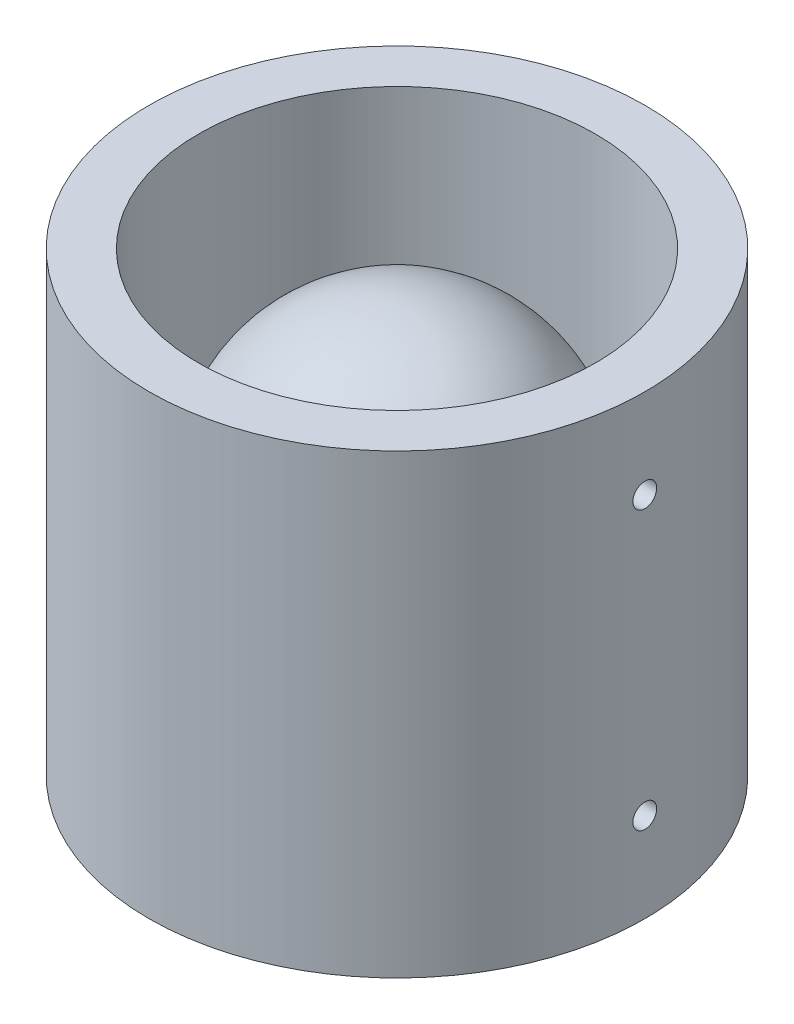
from build123d import *

# Parameters (mm, degrees)
SKETCH1_W               = 2
SKETCH1_H               = 1
SKETCH1_W_2             = 2.5
SKETCH1_H_2             = 23
CUT_EXTRUDE1_REACH      = 38.197
CUT_EXTRUDE1_END_RADIUS = 10


with BuildPart() as part:
    # Sketch1 → Revolve1 (revolve)
    with BuildSketch(Plane.XY, mode=Mode.PRIVATE) as revolve1_sk:
        with BuildLine():
            Line((0, 20.5), (0, 18.9))
            ThreePointArc((0, 18.9), (5.024937811, 16.693186096), (6.8, 11.5))
            Line((6.8, 11.5), (8, 11.5))
            Line((8, 11.5), (8, 12.5))
            ThreePointArc((8, 12.5), (5.656854249, 18.156854249), (0, 20.5))
        make_face()
        with Locations((9, 12)):
            Rectangle(SKETCH1_W, SKETCH1_H)
        with Locations((11.25, 11.5)):
            Rectangle(SKETCH1_W_2, SKETCH1_H_2)
    revolve(revolve1_sk.sketch.rotate(Axis((0, 0, 0), (0, 1, 0)), 90), axis=Axis((0, 0, 0), (0, 1, 0)))

    # Cut-Extrude1: up to this cylinder (the profile starts outside it)
    cut_extrude1_end = Plane(origin=(0, 11.5, 0), z_dir=(0, -1, 0)) * Cylinder(CUT_EXTRUDE1_END_RADIUS, 111.394, mode=Mode.PRIVATE)
    # Sketch2 → Cut-Extrude1 (cut, up to the surface)
    with BuildSketch(Plane(origin=(12.5, 0, 0), x_dir=(0, 0, -1), z_dir=(1, 0, 0)), mode=Mode.PRIVATE) as cut_extrude1_sk1:
        with BuildLine():
            ThreePointArc((0, 19.1), (-0.6, 18.5), (0, 17.9))
            Line((0, 17.9), (0, 19.1))
        make_face()
    cut_extrude1_tool1 = extrude(cut_extrude1_sk1.sketch, amount=-CUT_EXTRUDE1_REACH, mode=Mode.PRIVATE) - cut_extrude1_end
    add(cut_extrude1_tool1.solids().sort_by_distance((12.5, 18.5, 0.254648))[0], mode=Mode.SUBTRACT)
    # Sketch2 → Cut-Extrude1 (cut, up to the surface)
    with BuildSketch(Plane(origin=(12.5, 0, 0), x_dir=(0, 0, -1), z_dir=(1, 0, 0)), mode=Mode.PRIVATE) as cut_extrude1_sk2:
        with BuildLine():
            Line((0, 19.1), (0, 17.9))
            ThreePointArc((0, 17.9), (0.424264069, 18.075735931), (0.6, 18.5))
            ThreePointArc((0.6, 18.5), (0.424264069, 18.924264069), (0, 19.1))
        make_face()
    cut_extrude1_tool2 = extrude(cut_extrude1_sk2.sketch, amount=-CUT_EXTRUDE1_REACH, mode=Mode.PRIVATE) - cut_extrude1_end
    add(cut_extrude1_tool2.solids().sort_by_distance((12.5, 18.5, -0.254648))[0], mode=Mode.SUBTRACT)
    # Sketch2 → Cut-Extrude1 (cut, up to the surface)
    with BuildSketch(Plane(origin=(12.5, 0, 0), x_dir=(0, 0, -1), z_dir=(1, 0, 0)), mode=Mode.PRIVATE) as cut_extrude1_sk3:
        with BuildLine():
            ThreePointArc((0, 19.1), (-0.6, 18.5), (0, 17.9))
            Line((0, 17.9), (0, 19.1))
        make_face()
    cut_extrude1_tool3 = extrude(cut_extrude1_sk3.sketch, amount=-CUT_EXTRUDE1_REACH, mode=Mode.PRIVATE) - cut_extrude1_end
    add(cut_extrude1_tool3.solids().sort_by_distance((12.5, 18.5, 0.254648))[0], mode=Mode.SUBTRACT)
    # Sketch2 → Cut-Extrude1 (cut, up to the surface)
    with BuildSketch(Plane(origin=(12.5, 0, 0), x_dir=(0, 0, -1), z_dir=(1, 0, 0)), mode=Mode.PRIVATE) as cut_extrude1_sk4:
        with BuildLine():
            Line((0, 19.1), (0, 17.9))
            ThreePointArc((0, 17.9), (0.424264069, 18.075735931), (0.6, 18.5))
            ThreePointArc((0.6, 18.5), (0.424264069, 18.924264069), (0, 19.1))
        make_face()
    cut_extrude1_tool4 = extrude(cut_extrude1_sk4.sketch, amount=-CUT_EXTRUDE1_REACH, mode=Mode.PRIVATE) - cut_extrude1_end
    add(cut_extrude1_tool4.solids().sort_by_distance((12.5, 18.5, -0.254648))[0], mode=Mode.SUBTRACT)
    # Sketch2 → Cut-Extrude1 (cut, up to the surface)
    with BuildSketch(Plane(origin=(12.5, 0, 0), x_dir=(0, 0, -1), z_dir=(1, 0, 0)), mode=Mode.PRIVATE) as cut_extrude1_sk5:
        with BuildLine():
            ThreePointArc((0, 5.1), (-0.6, 4.5), (0, 3.9))
            Line((0, 3.9), (0, 5.1))
        make_face()
    cut_extrude1_tool5 = extrude(cut_extrude1_sk5.sketch, amount=-CUT_EXTRUDE1_REACH, mode=Mode.PRIVATE) - cut_extrude1_end
    add(cut_extrude1_tool5.solids().sort_by_distance((12.5, 4.5, 0.254648))[0], mode=Mode.SUBTRACT)
    # Sketch2 → Cut-Extrude1 (cut, up to the surface)
    with BuildSketch(Plane(origin=(12.5, 0, 0), x_dir=(0, 0, -1), z_dir=(1, 0, 0)), mode=Mode.PRIVATE) as cut_extrude1_sk6:
        with BuildLine():
            Line((0, 5.1), (0, 3.9))
            ThreePointArc((0, 3.9), (0.424264069, 4.075735931), (0.6, 4.5))
            ThreePointArc((0.6, 4.5), (0.424264069, 4.924264069), (0, 5.1))
        make_face()
    cut_extrude1_tool6 = extrude(cut_extrude1_sk6.sketch, amount=-CUT_EXTRUDE1_REACH, mode=Mode.PRIVATE) - cut_extrude1_end
    add(cut_extrude1_tool6.solids().sort_by_distance((12.5, 4.5, -0.254648))[0], mode=Mode.SUBTRACT)
    # Sketch2 → Cut-Extrude1 (cut, up to the surface)
    with BuildSketch(Plane(origin=(12.5, 0, 0), x_dir=(0, 0, -1), z_dir=(1, 0, 0)), mode=Mode.PRIVATE) as cut_extrude1_sk7:
        with BuildLine():
            ThreePointArc((0, 5.1), (-0.6, 4.5), (0, 3.9))
            Line((0, 3.9), (0, 5.1))
        make_face()
    cut_extrude1_tool7 = extrude(cut_extrude1_sk7.sketch, amount=-CUT_EXTRUDE1_REACH, mode=Mode.PRIVATE) - cut_extrude1_end
    add(cut_extrude1_tool7.solids().sort_by_distance((12.5, 4.5, 0.254648))[0], mode=Mode.SUBTRACT)
    # Sketch2 → Cut-Extrude1 (cut, up to the surface)
    with BuildSketch(Plane(origin=(12.5, 0, 0), x_dir=(0, 0, -1), z_dir=(1, 0, 0)), mode=Mode.PRIVATE) as cut_extrude1_sk8:
        with BuildLine():
            Line((0, 5.1), (0, 3.9))
            ThreePointArc((0, 3.9), (0.424264069, 4.075735931), (0.6, 4.5))
            ThreePointArc((0.6, 4.5), (0.424264069, 4.924264069), (0, 5.1))
        make_face()
    cut_extrude1_tool8 = extrude(cut_extrude1_sk8.sketch, amount=-CUT_EXTRUDE1_REACH, mode=Mode.PRIVATE) - cut_extrude1_end
    add(cut_extrude1_tool8.solids().sort_by_distance((12.5, 4.5, -0.254648))[0], mode=Mode.SUBTRACT)


solid = part.part
